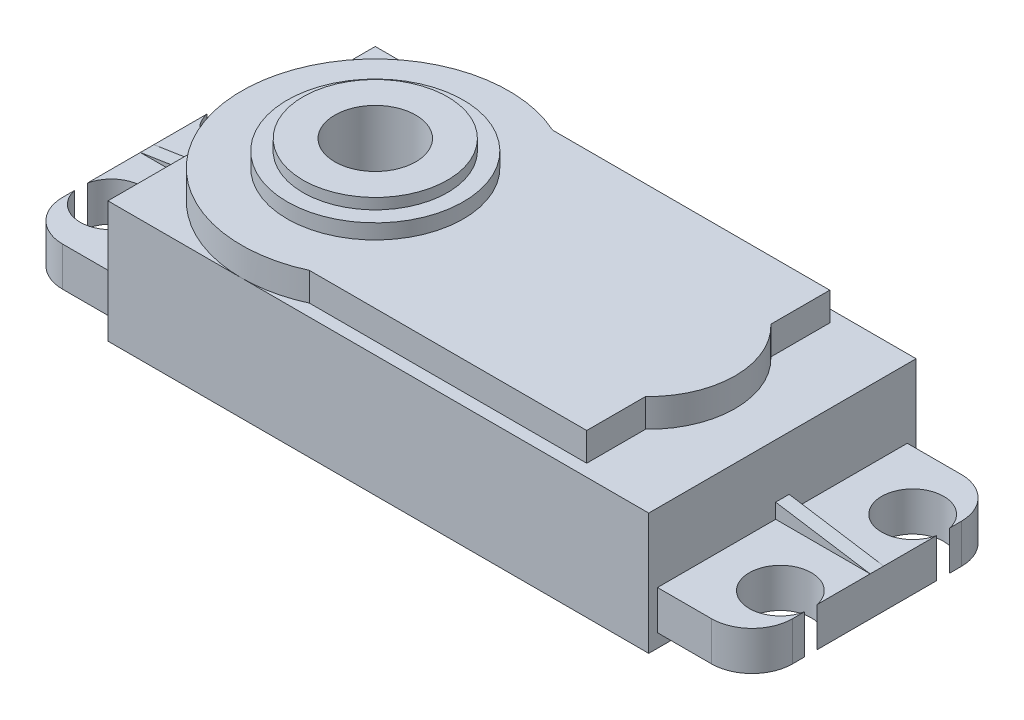
from build123d import *
from build123d.topology import SkipClean

# Parameters (mm, degrees)
SKETCH_1_W          = 40.05
SKETCH_1_H          = 19.8
EXTRUDE_1_DEPTH     = 9
SHELL_1_T           = -1.6
SKETCH_2_W          = 38.25
SKETCH_2_H          = 18
CUT_EXTRUDE_1_DEPTH = 1
EXTRUDE_2_DEPTH     = 2.1
SKETCH_4_R          = 6.525
EXTRUDE_3_DEPTH     = 1.1
SKETCH_5_R          = 5.35
EXTRUDE_4_DEPTH     = 0.8
CUT_EXTRUDE_START   = -5.6
SKETCH_6_R          = 3
CUT_EXTRUDE_2_DEPTH = 5.6
SKETCH_7_R          = 0.8
CUT_EXTRUDE_3_DEPTH = 14
SKETCH_8_R          = 1.6
SKETCH_8_R_2        = 0.8
EXTRUDE_5_DEPTH     = 6.4
SKETCH_9_R          = 0.8
EXTRUDE_6_DEPTH     = 1.6
EXTRUDE_7_DEPTH     = 7
CUT_EXTRUDE_4_DEPTH = 7
SKETCH_12_R         = 2.3
CUT_EXTRUDE_5_DEPTH = 7
EXTRUDE_8_DEPTH     = 7
SKETCH_16_R         = 2.3
CUT_EXTRUDE_6_DEPTH = 7
FILLET_1_R          = 3
CUT_EXTRUDE_7_DEPTH = 7


with BuildPart() as part:
    # Эскиз1 → Бобышка-Вытянуть1 (new body)
    with BuildSketch(Plane(origin=(0, 0, 0), x_dir=(1, 0, 0), z_dir=(0, 1, 0))):
        Rectangle(SKETCH_1_W, SKETCH_1_H)
    extrude(amount=EXTRUDE_1_DEPTH)

    # Оболочка1
    shell_1_openings = [part.faces().sort_by_distance(p)[0] for p in [
        (0, 0, 0),
    ]]
    offset(amount=SHELL_1_T, openings=shell_1_openings, kind=Kind.INTERSECTION)

    # Эскиз2 → Вырез-Вытянуть1 (cut)
    with BuildSketch(Plane.XZ):
        Rectangle(SKETCH_2_W, SKETCH_2_H)
    extrude(amount=-CUT_EXTRUDE_1_DEPTH, mode=Mode.SUBTRACT)

    # Эскиз3 → Бобышка-Вытянуть2 (add)
    with BuildSketch(Plane(origin=(0, 9, 0), x_dir=(1, 0, 0), z_dir=(0, 1, 0))):
        with BuildLine():
            Line((14.532872835, 4.640113908), (14.532872835, 9))
            Line((14.532872835, 9), (-6.000681875, 9))
            ThreePointArc((-6.000681875, 9), (-20.025, 0), (-6.000681875, -9))
            Line((-6.000681875, -9), (14.532872835, -9))
            Line((14.532872835, -9), (14.532872835, -4.640113908))
            ThreePointArc((14.532872835, -4.640113908), (16.525, 0), (14.532872835, 4.640113908))
        make_face()
    extrude(amount=EXTRUDE_2_DEPTH)

    # Эскиз4 → Бобышка-Вытянуть3 (add)
    with BuildSketch(Plane(origin=(0, 11.1, 0), x_dir=(1, 0, 0), z_dir=(0, 1, 0))):
        with Locations(Location((-10.125, 0, 0), (0, 0, 270))):
            Circle(SKETCH_4_R)
    extrude(amount=EXTRUDE_3_DEPTH)

    # Эскиз5 → Бобышка-Вытянуть4 (add)
    with BuildSketch(Plane(origin=(0, 12.2, 0), x_dir=(1, 0, 0), z_dir=(0, 1, 0))):
        with Locations(Location((-10.125, 0, 0), (0, 0, 270))):
            Circle(SKETCH_5_R)
    extrude(amount=EXTRUDE_4_DEPTH)

    # Эскиз6 → Вырез-Вытянуть2 (cut)
    with BuildSketch(Plane(origin=(0, 13, 0), x_dir=(1, 0, 0), z_dir=(0, 1, 0)).offset(CUT_EXTRUDE_START)):
        with Locations(Location((-10.125, 0, 0), (0, 0, 270))):
            Circle(SKETCH_6_R)
    extrude(amount=CUT_EXTRUDE_2_DEPTH, mode=Mode.SUBTRACT)

    # Эскиз7 → Вырез-Вытянуть3 (cut)
    with BuildSketch(Plane(origin=(0, 11.1, 0), x_dir=(1, 0, 0), z_dir=(0, 1, 0))):
        with Locations(Location((-18.2, 7.4, 0), (0, 0, 253.665177219))):
            Circle(SKETCH_7_R)
        with Locations(Location((18.2, 7.4, 0), (0, 0, 286.334822781))):
            Circle(SKETCH_7_R)
        with Locations(Location((18.2, -7.4, 0), (0, 0, 286.334822781))):
            Circle(SKETCH_7_R)
        with Locations(Location((-18.2, -7.4, 0), (0, 0, 253.665177219))):
            Circle(SKETCH_7_R)
    extrude(amount=-CUT_EXTRUDE_3_DEPTH, mode=Mode.SUBTRACT)

    # Эскиз8 → Бобышка-Вытянуть5 (add)
    # profile 1 of 4: a face of its own
    with SkipClean():  # the faces are left unmerged after this step: merging them gives an invalid solid
        with BuildSketch(Plane(origin=(0, 7.4, 0), x_dir=(-1, 0, 0), z_dir=(0, -1, 0))):
            with Locations((18.2, -7.4)):
                Circle(SKETCH_8_R)
            with Locations(Location((18.2, -7.4, 0), (0, 0, 270))):
                Circle(SKETCH_8_R_2, mode=Mode.SUBTRACT)
        # profile 2 of 4: a face of its own
        with BuildSketch(Plane(origin=(0, 7.4, 0), x_dir=(-1, 0, 0), z_dir=(0, -1, 0))):
            with Locations((18.2, 7.4)):
                Circle(SKETCH_8_R)
            with Locations(Location((18.2, 7.4, 0), (0, 0, 270))):
                Circle(SKETCH_8_R_2, mode=Mode.SUBTRACT)
        # profile 3 of 4: a face of its own
        with BuildSketch(Plane(origin=(0, 7.4, 0), x_dir=(-1, 0, 0), z_dir=(0, -1, 0))):
            with Locations((-18.2, 7.4)):
                Circle(SKETCH_8_R)
            with Locations(Location((-18.2, 7.4, 0), (0, 0, 270))):
                Circle(SKETCH_8_R_2, mode=Mode.SUBTRACT)
        # profile 4 of 4: a face of its own
        with BuildSketch(Plane(origin=(0, 7.4, 0), x_dir=(-1, 0, 0), z_dir=(0, -1, 0))):
            with Locations((-18.2, -7.4)):
                Circle(SKETCH_8_R)
            with Locations(Location((-18.2, -7.4, 0), (0, 0, 270))):
                Circle(SKETCH_8_R_2, mode=Mode.SUBTRACT)
        extrude(amount=EXTRUDE_5_DEPTH)

    # Эскиз9 → Бобышка-Вытянуть6 (add)
    with BuildSketch(Plane(origin=(0, 9, 0), x_dir=(1, 0, 0), z_dir=(0, 1, 0))):
        with Locations(Location((18.2, 7.4, 0), (0, 0, 270))):
            Circle(SKETCH_9_R)
        with Locations(Location((18.2, -7.4, 0), (0, 0, 270))):
            Circle(SKETCH_9_R)
        with Locations(Location((-18.2, -7.4, 0), (0, 0, 270))):
            Circle(SKETCH_9_R)
        with Locations(Location((-18.2, 7.4, 0), (0, 0, 270))):
            Circle(SKETCH_9_R)
    extrude(amount=-EXTRUDE_6_DEPTH)

    # Эскиз10 → Бобышка-Вытянуть7 (add)
    with BuildSketch(Plane(origin=(20.025, 0, 0), x_dir=(0, 0, -1), z_dir=(1, 0, 0))):
        Polygon((9.25, 1), (-9.25, 1), (-9.25, 3.9), (-0.5, 3.9), (-0.5, 5), (0.5, 5), (0.5, 3.9), (9.25, 3.9), align=None)
    extrude(amount=EXTRUDE_7_DEPTH)

    # Эскиз11 → Вырез-Вытянуть4 (cut)
    with BuildSketch(Plane.XY.offset(0.5)):
        Polygon((20.025, 5), (27.025, 3.9), (27.025, 5), align=None)
    extrude(amount=-CUT_EXTRUDE_4_DEPTH, mode=Mode.SUBTRACT)

    # Эскиз12 → Вырез-Вытянуть5 (cut)
    with BuildSketch(Plane(origin=(0, 3.9, 0), x_dir=(1, 0, 0), z_dir=(0, 1, 0))):
        with Locations((24.775, -4.9)):
            Circle(SKETCH_12_R)
        with Locations((24.775, 4.9)):
            Circle(SKETCH_12_R)
    extrude(amount=-CUT_EXTRUDE_5_DEPTH, mode=Mode.SUBTRACT)

    # Эскиз15 → Бобышка-Вытянуть8 (add)
    with BuildSketch(Plane.ZY.offset(20.025)):
        Polygon((-0.5, 3.9), (-9.25, 3.9), (-9.25, 1), (9.25, 1), (9.25, 3.9), (0.5, 3.9), (0.5, 5), (-0.5, 5), align=None)
    extrude(amount=EXTRUDE_8_DEPTH)

    # Эскиз16 → Вырез-Вытянуть6 (cut)
    with BuildSketch(Plane(origin=(0, 3.9, 0), x_dir=(1, 0, 0), z_dir=(0, 1, 0))):
        with Locations((-24.775, 4.9)):
            Circle(SKETCH_16_R)
        with Locations((-24.775, -4.9)):
            Circle(SKETCH_16_R)
    extrude(amount=-CUT_EXTRUDE_6_DEPTH, mode=Mode.SUBTRACT)

    # Скругление1
    fillet_1_edges = [part.edges().sort_by_distance(p)[0] for p in [
        (27.025, 2.45, -9.25),
        (27.025, 2.45, 9.25),
        (-27.025, 2.45, 9.25),
        (-27.025, 2.45, -9.25),
    ]]
    fillet(fillet_1_edges, radius=FILLET_1_R)

    # Эскиз17 → Вырез-Вытянуть7 (cut)
    with BuildSketch(Plane.XY.offset(0.5)):
        Polygon((-27.025, 3.9), (-20.025, 5), (-27.025, 5), align=None)
    extrude(amount=-CUT_EXTRUDE_7_DEPTH, mode=Mode.SUBTRACT)


solid = part.part
